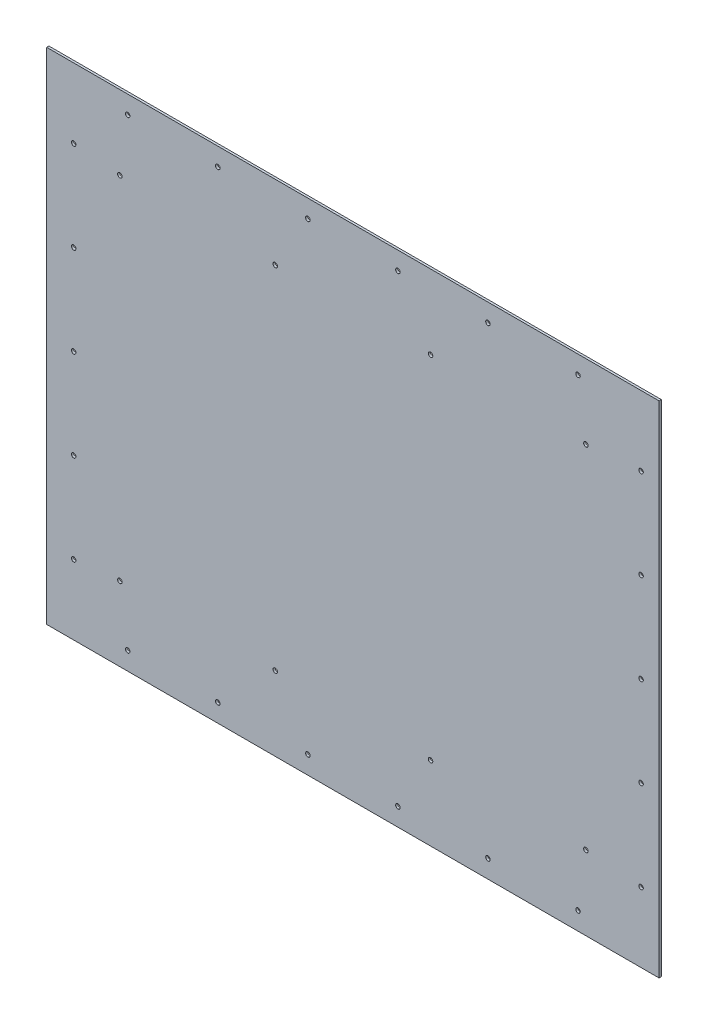
from build123d import *

# Parameters (mm, degrees)
SKETCH1_W                   = 863.6
SKETCH1_H                   = 704.85
BOSS_EXTRUDE1_DEPTH         = 3.175
F_1_4_0_25_DIAMETER_HOLE4_D = 6.35
LPATTERN1_COUNT             = 5
LPATTERN1_PITCH             = 127
F_1_4_0_25_DIAMETER_HOLE2_D = 6.35
LPATTERN2_COUNT             = 6
LPATTERN2_PITCH             = 127
LPATTERN2_COUNT_DIR2        = 2
LPATTERN2_PITCH_DIR2        = 654.05
F_1_4_0_25_DIAMETER_HOLE3_D = 6.35
LPATTERN3_COUNT             = 5
LPATTERN3_PITCH             = 127
F_1_4_0_25_DIAMETER_HOLE5_D = 6.35
LPATTERN4_COUNT             = 4
LPATTERN4_PITCH             = 219.075
LPATTERN4_COUNT_DIR2        = 2
LPATTERN4_PITCH_DIR2        = 495.3


with BuildPart() as part:
    # Sketch1 → Boss-Extrude1 (new body)
    with BuildSketch(Plane.XY):
        with Locations((431.8, 352.425)):
            Rectangle(SKETCH1_W, SKETCH1_H)
    extrude(amount=BOSS_EXTRUDE1_DEPTH)

    # 1/4 (0.25) Diameter Hole4 (through all)
    with Locations(Plane.XY.offset(3.175)):
        with Locations((38.1, 98.425)):
            f_1_4_0_25_diameter_hole4 = Hole(F_1_4_0_25_DIAMETER_HOLE4_D / 2)

    # LPattern1: 1/4 (0.25) Diameter Hole4 ×5
    with Locations(*[(0, i * LPATTERN1_PITCH, 0) for i in range(1, LPATTERN1_COUNT)]):
        add(f_1_4_0_25_diameter_hole4, mode=Mode.SUBTRACT)

    # 1/4 (0.25) Diameter Hole2 (through all)
    with Locations(Plane.XY.offset(3.175)):
        with Locations((749.3, 25.4)):
            f_1_4_0_25_diameter_hole2 = Hole(F_1_4_0_25_DIAMETER_HOLE2_D / 2)

    # LPattern2: 1_4 _0.25_ Diameter Hole2 6 × 2
    with Locations(*[(-i * LPATTERN2_PITCH, j * LPATTERN2_PITCH_DIR2, 0) for i in range(LPATTERN2_COUNT) for j in range(LPATTERN2_COUNT_DIR2) if (i, j) != (0, 0)]):
        add(f_1_4_0_25_diameter_hole2, mode=Mode.SUBTRACT)

    # 1/4 (0.25) Diameter Hole3 (through all)
    with Locations(Plane.XY.offset(3.175)):
        with Locations((838.2, 98.425)):
            f_1_4_0_25_diameter_hole3 = Hole(F_1_4_0_25_DIAMETER_HOLE3_D / 2)

    # LPattern3: 1/4 (0.25) Diameter Hole3 ×5
    with Locations(*[(0, i * LPATTERN3_PITCH, 0) for i in range(1, LPATTERN3_COUNT)]):
        add(f_1_4_0_25_diameter_hole3, mode=Mode.SUBTRACT)

    # 1/4 (0.25) Diameter Hole5 (through all)
    with Locations(Plane.XY.offset(3.175)):
        with Locations((103.1875, 104.775)):
            f_1_4_0_25_diameter_hole5 = Hole(F_1_4_0_25_DIAMETER_HOLE5_D / 2)

    # LPattern4: 1_4 _0.25_ Diameter Hole5 4 × 2
    with Locations(*[(i * LPATTERN4_PITCH, j * LPATTERN4_PITCH_DIR2, 0) for i in range(LPATTERN4_COUNT) for j in range(LPATTERN4_COUNT_DIR2) if (i, j) != (0, 0)]):
        add(f_1_4_0_25_diameter_hole5, mode=Mode.SUBTRACT)


solid = part.part
